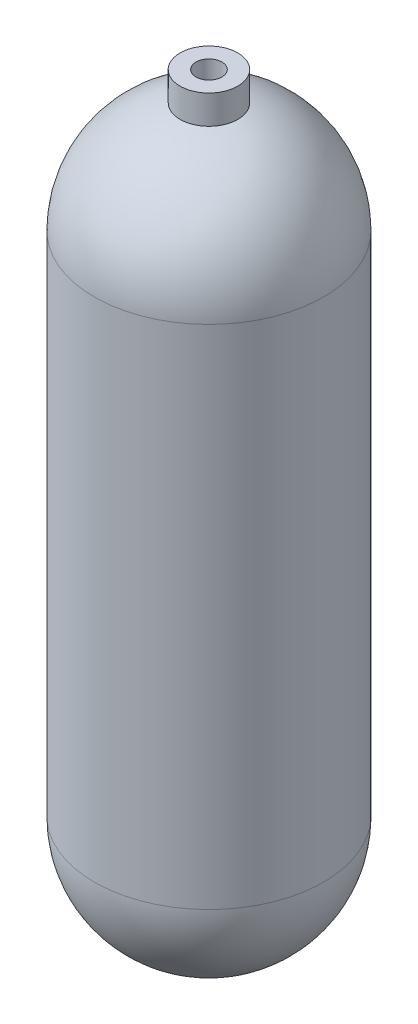
from build123d import *


with BuildPart() as part:
    # Sketch1 → Revolve1 (revolve)
    with BuildSketch(Plane.XY):
        with BuildLine():
            Line((-9, 0), (-9, -20))
            Line((-9, -20), (0, -20))
            Line((0, -20), (0, -528))
            ThreePointArc((0, -528), (-56.218645569, -504.716989077), (-79.505656307, -448.500000201))
            Line((-79.505656307, -448.500000201), (-79.505656307, -96.944630874))
            ThreePointArc((-79.505656307, -96.944630874), (-62.893653269, -48.309768499), (-20, -20))
            Line((-20, -20), (-20, 0))
            Line((-20, 0), (-9, 0))
        make_face()
    revolve(axis=Axis((0, 0, 0), (0, -1, 0)))


solid = part.part
